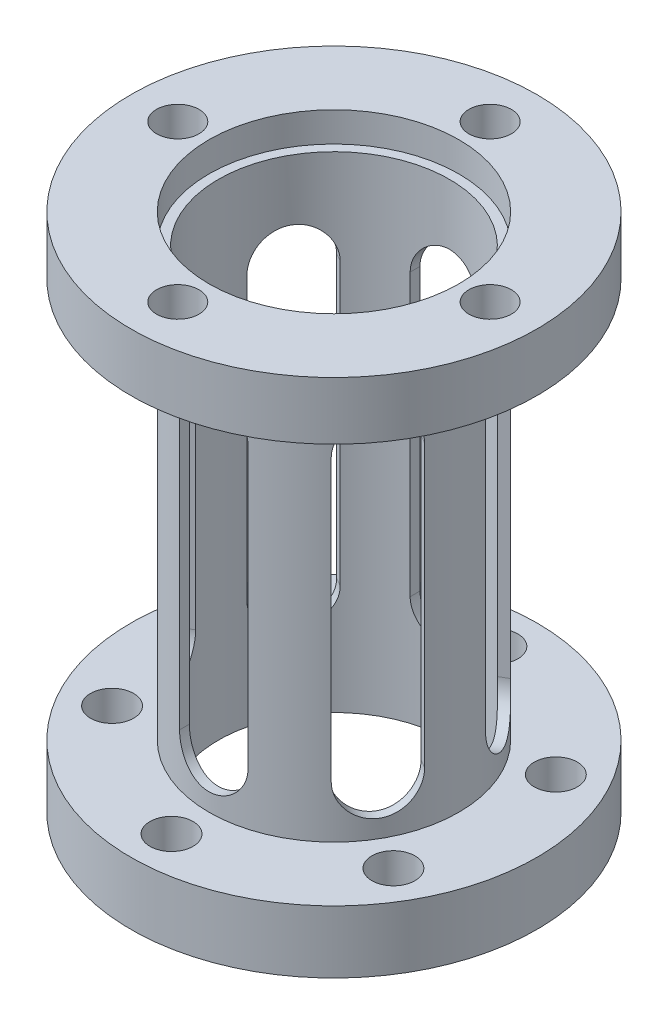
from build123d import *

# Parameters (mm, degrees)
SKETCH1_R           = 16.51
BOSS_EXTRUDE1_DEPTH = 44.831
SKETCH2_R           = 9.398
CUT_EXTRUDE1_DEPTH  = 51.546797732
SKETCH3_R           = 10.16
CUT_EXTRUDE2_DEPTH  = 4.953
SKETCH4_R           = 1.7272
CUT_EXTRUDE3_DEPTH  = 12.7
CIRPATTERN1_COUNT   = 4
CUT_EXTRUDE4_START  = -0.381
SKETCH5_R           = 10.16
CUT_EXTRUDE4_DEPTH  = 0.381
SKETCH7_W           = 9.037015708
SKETCH7_H           = 32.512
SKETCH9_R           = 1.7526
CUT_EXTRUDE6_DEPTH  = 10.16
CIRPATTERN3_COUNT   = 6
CUT_EXTRUDE7_DEPTH  = 15.24
CIRPATTERN4_COUNT   = 6
CUT_EXTRUDE8_START  = -2.54
SKETCH13_R          = 16.51
CUT_EXTRUDE8_DEPTH  = 2.54


with BuildPart() as part:
    # Sketch1 → Boss-Extrude1 (new body)
    with BuildSketch(Plane(origin=(0, 0, 0), x_dir=(1, 0, 0), z_dir=(0, 1, 0))):
        with Locations(Location((0, 0, 0), (0, 0, 90))):
            Circle(SKETCH1_R)
    extrude(amount=BOSS_EXTRUDE1_DEPTH)

    # Sketch2 → Cut-Extrude1 (cut, through all)
    with BuildSketch(Plane(origin=(0, 44.831, 0), x_dir=(1, 0, 0), z_dir=(0, 1, 0))):
        with Locations(Location((0, 0, 0), (0, 0, 270))):
            Circle(SKETCH2_R)
    extrude(amount=-CUT_EXTRUDE1_DEPTH, mode=Mode.SUBTRACT)

    # Sketch3 → Cut-Extrude2 (cut)
    with BuildSketch(Plane(origin=(0, 44.831, 0), x_dir=(1, 0, 0), z_dir=(0, 1, 0))):
        with Locations(Location((0, 0, 0), (0, 0, 270))):
            Circle(SKETCH3_R)
    extrude(amount=-CUT_EXTRUDE2_DEPTH, mode=Mode.SUBTRACT)

    # Sketch4 → Cut-Extrude3 (cut)
    with BuildSketch(Plane(origin=(0, 44.831, 0), x_dir=(1, 0, 0), z_dir=(0, 1, 0))):
        with Locations(Location((-12.7, 0, 0), (0, 0, 270))):
            Circle(SKETCH4_R)
    cut_extrude3 = extrude(amount=-CUT_EXTRUDE3_DEPTH, mode=Mode.SUBTRACT)

    # CirPattern1: Cut-Extrude3 ×4 about axis
    cirpattern1_axis = Axis((0, 0, 0), (0, 1, 0))
    for i in range(1, CIRPATTERN1_COUNT):
        add(cut_extrude3.rotate(cirpattern1_axis, i * 360 / CIRPATTERN1_COUNT), mode=Mode.SUBTRACT)

    # Sketch5 → Cut-Extrude4 (cut)
    with BuildSketch(Plane.XZ.offset(CUT_EXTRUDE4_START)):
        with Locations(Location((0, 0, 0), (0, 0, 90))):
            Circle(SKETCH5_R)
    extrude(amount=CUT_EXTRUDE4_DEPTH, mode=Mode.SUBTRACT)

    # Sketch7 → Cut-Revolve2 (revolve, cut)
    with BuildSketch(Plane.XY, mode=Mode.PRIVATE) as cut_revolve2_sk:
        with Locations((-14.678507762, 21.336)):
            Rectangle(SKETCH7_W, SKETCH7_H)
    cut_revolve2 = revolve(cut_revolve2_sk.sketch.rotate(Axis((0, 0, 0), (0, 1, 0)), 270), axis=Axis((0, 0, 0), (0, 1, 0)), mode=Mode.SUBTRACT)

    # Sketch9 → Cut-Extrude6 (cut)
    with BuildSketch(Plane.XZ):
        with Locations(Location((0, -13.208, 0), (0, 0, 270))):
            Circle(SKETCH9_R)
    cut_extrude6 = extrude(amount=-CUT_EXTRUDE6_DEPTH, mode=Mode.SUBTRACT)

    # CirPattern3: Cut-Extrude6 ×6 about axis
    cirpattern3_axis = Axis((0, 0, 0), (0, 1, 0))
    for i in range(1, CIRPATTERN3_COUNT):
        add(cut_extrude6.rotate(cirpattern3_axis, i * 360 / CIRPATTERN3_COUNT), mode=Mode.SUBTRACT)

    # Sketch12 → Cut-Extrude7 (cut)
    with BuildSketch(Plane.XY.offset(16.51)):
        with BuildLine():
            Line((2.780051948, 32.164471738), (2.780051948, 9.304471738))
            ThreePointArc((2.780051948, 9.304471738), (0, 6.52441979), (-2.780051948, 9.304471738))
            Line((-2.780051948, 9.304471738), (-2.780051948, 32.164471738))
            ThreePointArc((-2.780051948, 32.164471738), (0, 34.944523686), (2.780051948, 32.164471738))
        make_face()
    cut_extrude7 = extrude(amount=-CUT_EXTRUDE7_DEPTH, mode=Mode.SUBTRACT)

    # CirPattern4: Cut-Revolve2, Cut-Extrude7 ×6 about axis
    cirpattern4_axis = Axis((0, 0, 0), (0, 1, 0))
    add([cut_revolve2.rotate(cirpattern4_axis, i * 360 / CIRPATTERN4_COUNT) for i in range(1, CIRPATTERN4_COUNT)], mode=Mode.SUBTRACT)
    add([cut_extrude7.rotate(cirpattern4_axis, i * 360 / CIRPATTERN4_COUNT) for i in range(1, CIRPATTERN4_COUNT)], mode=Mode.SUBTRACT)

    # Sketch13 → Cut-Extrude8 (cut)
    with BuildSketch(Plane(origin=(0, 44.831, 0), x_dir=(1, 0, 0), z_dir=(0, 1, 0)).offset(CUT_EXTRUDE8_START)):
        with Locations(Location((0, 0, 0), (0, 0, 90))):
            Circle(SKETCH13_R)
    extrude(amount=CUT_EXTRUDE8_DEPTH, mode=Mode.SUBTRACT)


solid = part.part
